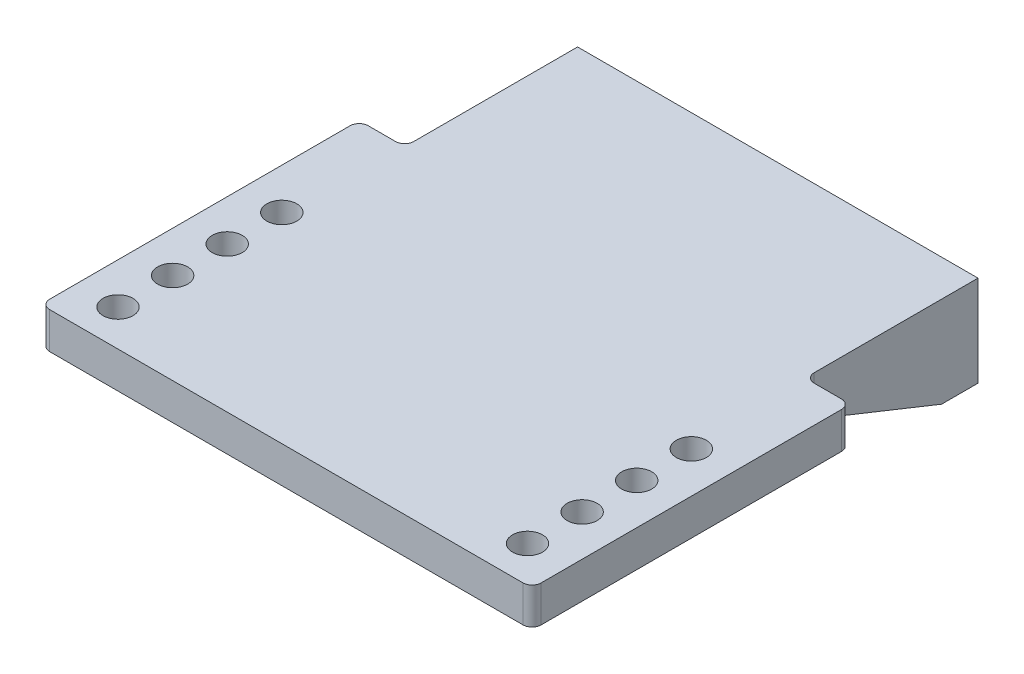
from build123d import *

# Parameters (mm, degrees)
SKETCH1_W             = 44
SKETCH1_H             = 10
SKETCH1_R             = 1.65
BOSS_EXTRUDE1_DEPTH   = 4
SKETCH2_W             = 44
SKETCH2_H             = 4
BOSS_EXTRUDE2_DEPTH   = 50
RIB6_REACH            = 72.37
SKETCH5_WALL_W        = 158.896391108
SKETCH5_WALL_H        = 3
LPATTERN1_COUNT       = 3
LPATTERN1_PITCH       = 20.5
SKETCH7_W             = 4
SKETCH7_H             = 35
BOSS_EXTRUDE3_DEPTH   = 5
SKETCH8_W             = 4
SKETCH8_H             = 35
BOSS_EXTRUDE4_DEPTH   = 5
FILLET1_R             = 1
SKETCH9_R             = 1.65
CUT_EXTRUDE1_DEPTH    = 74.164198895
LPATTERN2_COUNT       = 4
LPATTERN2_PITCH       = 6
BODY_MOVE_COPY1_ANGLE = 90


with BuildPart() as part:
    # Sketch1 → Boss-Extrude1 (new body)
    with BuildSketch(Plane(origin=(0, 0, 0), x_dir=(1, 0, 0), z_dir=(0, 1, 0))):
        with Locations((22, 5)):
            Rectangle(SKETCH1_W, SKETCH1_H)
        with Locations(Location((38, 3, 0), (0, 0, 270))):
            Circle(SKETCH1_R, mode=Mode.SUBTRACT)
        with Locations(Location((6, 3, 0), (0, 0, 270))):
            Circle(SKETCH1_R, mode=Mode.SUBTRACT)
    extrude(amount=BOSS_EXTRUDE1_DEPTH)

    # Sketch2 → Boss-Extrude2 (add)
    with BuildSketch(Plane(origin=(0, 4, 0), x_dir=(1, 0, 0), z_dir=(0, 1, 0))):
        with Locations((22, 8)):
            Rectangle(SKETCH2_W, SKETCH2_H)
    extrude(amount=BOSS_EXTRUDE2_DEPTH)

    # Sketch5 wall → Rib6 (add, up to next)
    with BuildSketch(Plane(origin=(44, 11.5, -3), x_dir=(0, -0.928476690885, 0.371390676354), z_dir=(0, -0.371390676354, -0.928476690885)), mode=Mode.PRIVATE) as rib6_sk1:
        with Locations((0, 1.5)):
            Rectangle(SKETCH5_WALL_W, SKETCH5_WALL_H)
    rib6_tool1 = extrude(rib6_sk1.sketch, amount=RIB6_REACH, mode=Mode.PRIVATE) - part.part
    rib6 = rib6_tool1.solids().sort_by_distance((44, 11.5, -3))[0]
    add(rib6)

    # LPattern1: Rib6 ×3
    with Locations(*[(-i * LPATTERN1_PITCH, 0, 0) for i in range(1, LPATTERN1_COUNT)]):
        add(rib6)

    # Sketch7 → Boss-Extrude3 (add)
    with BuildSketch(Plane(origin=(44, 0, 0), x_dir=(0, 0, -1), z_dir=(1, 0, 0))):
        with Locations((8, 36.5)):
            Rectangle(SKETCH7_W, SKETCH7_H)
    extrude(amount=BOSS_EXTRUDE3_DEPTH)

    # Sketch8 → Boss-Extrude4 (add)
    with BuildSketch(Plane.ZY):
        with Locations((-8, 36.5)):
            Rectangle(SKETCH8_W, SKETCH8_H)
    extrude(amount=BOSS_EXTRUDE4_DEPTH)

    # Fillet1
    fillet1_edges = [part.edges().sort_by_distance(p)[0] for p in [
        (44, 19, -8),
        (49, 19, -8),
        (49, 54, -8),
        (0, 19, -8),
        (-5, 54, -8),
        (-5, 19, -8),
    ]]
    fillet(fillet1_edges, radius=FILLET1_R)

    # Sketch9 → Cut-Extrude1 (cut, through all)
    with BuildSketch(Plane.XY.offset(-6)):
        with Locations((-0.5, 32)):
            Circle(SKETCH9_R)
        with Locations((44.5, 32)):
            Circle(SKETCH9_R)
    cut_extrude1 = extrude(amount=-CUT_EXTRUDE1_DEPTH, mode=Mode.SUBTRACT)

    # LPattern2: Cut-Extrude1 ×4
    with Locations(*[(0, i * LPATTERN2_PITCH, 0) for i in range(1, LPATTERN2_COUNT)]):
        add(cut_extrude1, mode=Mode.SUBTRACT)


with BuildPart() as part_1:
    # Body-Move/Copy1: moved
    add(part.part.rotate(Axis((0, 27, -5), (1, 0, 0)), BODY_MOVE_COPY1_ANGLE))


solid = part_1.part
